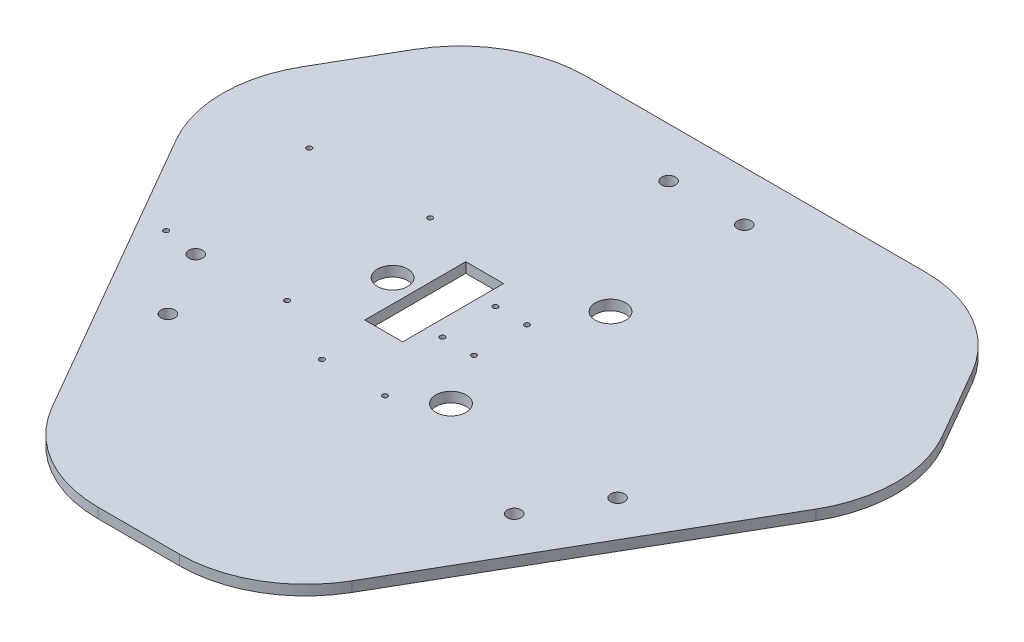
from build123d import *

# Parameters (mm, degrees)
SKETCH1_W           = 100
SKETCH1_H           = 80
BOSS_EXTRUDE1_DEPTH = 4
SKETCH2_R           = 1
CUT_EXTRUDE1_DEPTH  = 65.156059729
BOSS_EXTRUDE2_DEPTH = 4
SKETCH4_R           = 1
CUT_EXTRUDE2_DEPTH  = 4
SKETCH5_R           = 1
CUT_EXTRUDE3_DEPTH  = 4
SKETCH6_R           = 6
CUT_EXTRUDE4_DEPTH  = 95.424573073
BOSS_EXTRUDE3_DEPTH = 4
SKETCH8_R           = 2.75
CUT_EXTRUDE5_DEPTH  = 308.949597178
CUT_EXTRUDE6_DEPTH  = 308.949597178
SKETCH11_R          = 1
SKETCH11_R_2        = 6
SKETCH11_W          = 15
SKETCH11_H          = 40
CUT_EXTRUDE7_DEPTH  = 4
SKETCH14_R          = 1
SKETCH14_R_2        = 6
BOSS_EXTRUDE5_DEPTH = 4
SKETCH15_R          = 6
CUT_EXTRUDE8_DEPTH  = 256.598728949
FILLET1_R           = 50


with BuildPart() as part:
    # Sketch1 → Boss-Extrude1 (new body)
    with BuildSketch(Plane(origin=(0, 0, 0), x_dir=(1, 0, 0), z_dir=(0, 1, 0))):
        Rectangle(SKETCH1_W, SKETCH1_H)
    extrude(amount=BOSS_EXTRUDE1_DEPTH)

    # Sketch2 → Cut-Extrude1 (cut, through all)
    with BuildSketch(Plane(origin=(0, 4, 0), x_dir=(1, 0, 0), z_dir=(0, 1, 0))):
        with Locations((-40, 30)):
            Circle(SKETCH2_R)
        with Locations((16.7, 30)):
            Circle(SKETCH2_R)
        with Locations((16.7, -17.9)):
            Circle(SKETCH2_R)
        with Locations((-40, -17.9)):
            Circle(SKETCH2_R)
    extrude(amount=-CUT_EXTRUDE1_DEPTH, mode=Mode.SUBTRACT)

    # Sketch3 → Boss-Extrude2 (add)
    with BuildSketch(Plane(origin=(0, 4, 0), x_dir=(1, 0, 0), z_dir=(0, 1, 0))):
        Polygon((7.993464363, -40), (50, -40), (50, -80), (-50, -80), (-50, -40), (-32.006535637, -40), (-32.006535637, -55), (7.993464363, -55), align=None)
    extrude(amount=-BOSS_EXTRUDE2_DEPTH)

    # Sketch4 → Cut-Extrude2 (cut)
    with BuildSketch(Plane(origin=(0, 4, 0), x_dir=(1, 0, 0), z_dir=(0, 1, 0))):
        with Locations((-22.506535637, -61.25)):
            Circle(SKETCH4_R)
        with Locations((-22.506535637, -73.75)):
            Circle(SKETCH4_R)
        with Locations((-1.506535637, -73.75)):
            Circle(SKETCH4_R)
        with Locations((-1.506535637, -61.25)):
            Circle(SKETCH4_R)
    extrude(amount=-CUT_EXTRUDE2_DEPTH, mode=Mode.SUBTRACT)

    # Sketch5 → Cut-Extrude3 (cut)
    with BuildSketch(Plane(origin=(0, 4, 0), x_dir=(1, 0, 0), z_dir=(0, 1, 0))):
        with Locations((30, -45)):
            Circle(SKETCH5_R)
        with Locations((30, -70)):
            Circle(SKETCH5_R)
    extrude(amount=-CUT_EXTRUDE3_DEPTH, mode=Mode.SUBTRACT)

    # Sketch6 → Cut-Extrude4 (cut, through all)
    with BuildSketch(Plane(origin=(0, 4, 0), x_dir=(1, 0, 0), z_dir=(0, 1, 0))):
        with Locations((-12.006535637, -31)):
            Circle(SKETCH6_R)
    extrude(amount=-CUT_EXTRUDE4_DEPTH, mode=Mode.SUBTRACT)

    # Sketch7 → Boss-Extrude3 (add)
    with BuildSketch(Plane.XZ):
        with BuildLine():
            Line((-146.240473223, -40), (-50, -40))
            Line((-50, -40), (-50, 80))
            Line((-50, 80), (50, 80))
            Line((50, 80), (50, -40))
            Line((50, -40), (122.22740195, -40))
            ThreePointArc((122.22740195, -40), (148.208164063, -25), (148.208164063, 5))
            Line((148.208164063, 5), (13.974226477, 237.5))
            ThreePointArc((13.974226477, 237.5), (-12.006535637, 252.5), (-37.98729775, 237.5))
            Line((-37.98729775, 237.5), (-172.221235337, 5))
            ThreePointArc((-172.221235337, 5), (-172.221235337, -25), (-146.240473223, -40))
        make_face()
    extrude(amount=-BOSS_EXTRUDE3_DEPTH)

    # Sketch8 → Cut-Extrude5 (cut, through all)
    with BuildSketch(Plane.XZ):
        with Locations((-27.006535637, -20.35)):
            Circle(SKETCH8_R)
        with Locations((2.993464363, -20.35)):
            Circle(SKETCH8_R)
        with Locations((-80.586867359, 124.415381057)):
            Circle(SKETCH8_R)
        with Locations((-95.586867359, 98.434618943)):
            Circle(SKETCH8_R)
        with Locations((71.573796086, 98.434618943)):
            Circle(SKETCH8_R)
        with Locations((56.573796086, 124.415381057)):
            Circle(SKETCH8_R)
    extrude(amount=-CUT_EXTRUDE5_DEPTH, mode=Mode.SUBTRACT)

    # Sketch9 → Cut-Extrude6 (cut, through all)
    with BuildSketch(Plane(origin=(0, 4, 0), x_dir=(1, 0, 0), z_dir=(0, 1, 0))):
        with BuildLine():
            Line((-172.221235337, -5), (-153.20199745, -37.942286341))
            Line((-153.20199745, -37.942286341), (-108.20199745, 40))
            Line((-108.20199745, 40), (-146.240473223, 40))
            ThreePointArc((-146.240473223, 40), (-172.221235337, 25), (-172.221235337, -5))
        make_face()
        with BuildLine():
            Line((32.993464363, -204.557713659), (-57.006535637, -204.557713659))
            Line((-57.006535637, -204.557713659), (-37.98729775, -237.5))
            ThreePointArc((-37.98729775, -237.5), (-12.006535637, -252.5), (13.974226477, -237.5))
            Line((13.974226477, -237.5), (32.993464363, -204.557713659))
        make_face()
        with BuildLine():
            Line((122.22740195, 40), (84.188926177, 40))
            Line((84.188926177, 40), (129.188926177, -37.942286341))
            Line((129.188926177, -37.942286341), (148.208164063, -5))
            ThreePointArc((148.208164063, -5), (148.208164063, 25), (122.22740195, 40))
        make_face()
    extrude(amount=-CUT_EXTRUDE6_DEPTH, mode=Mode.SUBTRACT)

    # Sketch11 → Cut-Extrude7 (cut)
    with BuildSketch(Plane(origin=(0, 4, 0), x_dir=(1, 0, 0), z_dir=(0, 1, 0))):
        with Locations((-109.506535637, -96.206535637)):
            Circle(SKETCH11_R)
        with Locations((-109.506535637, -39.506535637)):
            Circle(SKETCH11_R)
        with Locations((-61.606535637, -39.506535637)):
            Circle(SKETCH11_R)
        with Locations((-61.606535637, -96.206535637)):
            Circle(SKETCH11_R)
        with Locations((-34.506535637, -109.506535637)):
            Circle(SKETCH11_R)
        with Locations((-9.506535637, -109.506535637)):
            Circle(SKETCH11_R)
        with Locations((-5.756535637, -78)):
            Circle(SKETCH11_R)
        with Locations((-18.256535637, -78)):
            Circle(SKETCH11_R)
        with Locations((-18.256535637, -57)):
            Circle(SKETCH11_R)
        with Locations((-5.756535637, -57)):
            Circle(SKETCH11_R)
        with Locations((-48.506535637, -67.5)):
            Circle(SKETCH11_R_2)
        with Locations((-32.006535637, -67.5)):
            Rectangle(SKETCH11_W, SKETCH11_H)
    extrude(amount=-CUT_EXTRUDE7_DEPTH, mode=Mode.SUBTRACT)

    # Sketch14 → Boss-Extrude5 (add)
    with BuildSketch(Plane(origin=(0, 4, 0), x_dir=(1, 0, 0), z_dir=(0, 1, 0))):
        Polygon((7.993464363, -40), (-32.006535637, -40), (-32.006535637, -47.5), (-24.506535637, -47.5), (-24.506535637, -55), (7.993464363, -55), align=None)
        with Locations((-22.506535637, -61.25)):
            Circle(SKETCH14_R)
        with Locations((-1.506535637, -61.25)):
            Circle(SKETCH14_R)
        with Locations((-22.506535637, -73.75)):
            Circle(SKETCH14_R)
        with Locations((-1.506535637, -73.75)):
            Circle(SKETCH14_R)
        with Locations((30, -70)):
            Circle(SKETCH14_R)
        with Locations((30, -45)):
            Circle(SKETCH14_R)
        with Locations((-12.006535637, -31)):
            Circle(SKETCH14_R_2)
        with Locations((-40, -17.9)):
            Circle(SKETCH14_R)
        with Locations((16.7, -17.9)):
            Circle(SKETCH14_R)
        with Locations((-40, 30)):
            Circle(SKETCH14_R)
        with Locations((16.7, 30)):
            Circle(SKETCH14_R)
    extrude(amount=-BOSS_EXTRUDE5_DEPTH)

    # Sketch15 → Cut-Extrude8 (cut, through all)
    with BuildSketch(Plane(origin=(0, 4, 0), x_dir=(1, 0, 0), z_dir=(0, 1, 0))):
        with Locations((-48.506535637, -67.5)):
            Circle(SKETCH15_R)
        with Locations((6.243464363, -99.109927238)):
            Circle(SKETCH15_R)
        with Locations((6.243464363, -35.890072762)):
            Circle(SKETCH15_R)
    extrude(amount=-CUT_EXTRUDE8_DEPTH, mode=Mode.SUBTRACT)

    # Fillet1
    fillet1_edges = [part.edges().sort_by_distance(p)[0] for p in [
        (-57.006535637, 2, 204.557713659),
        (32.993464363, 2, 204.557713659),
        (129.188926177, 2, 37.942286341),
        (84.188926177, 2, -40),
        (-108.20199745, 2, -40),
        (-153.20199745, 2, 37.942286341),
    ]]
    fillet(fillet1_edges, radius=FILLET1_R)


solid = part.part
